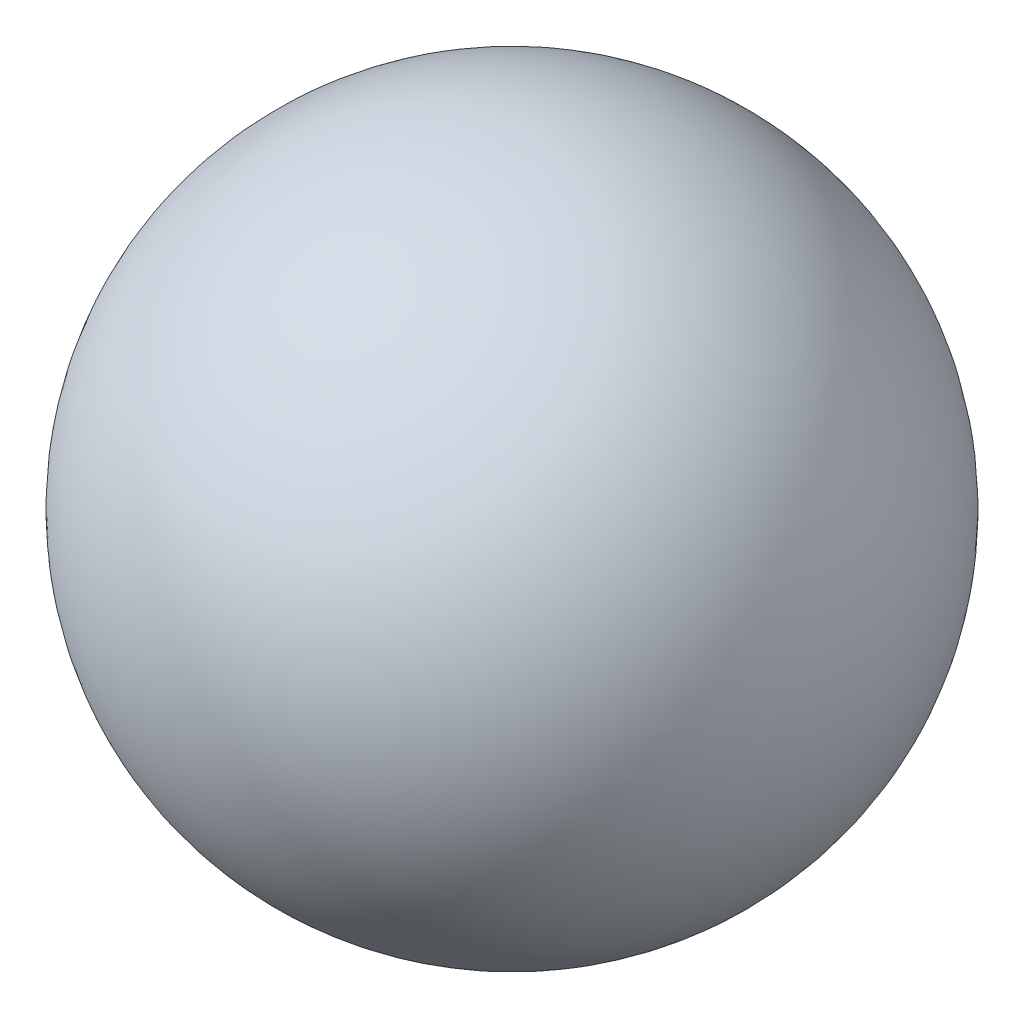
from build123d import *


with BuildPart() as part:
    # ｽｹｯﾁ1 → 回転1 (revolve)
    with BuildSketch(Plane.XY):
        with BuildLine():
            Line((1.658837345, 49.97247501), (0, -50))
            ThreePointArc((0, -50), (-49.993118279, 0.829532845), (1.658837345, 49.97247501))
        make_face()
    revolve(axis=Axis((1.658837345, 49.97247501, 0), (-0.01659065689286472, -0.9998623655803148, 0)))


solid = part.part
